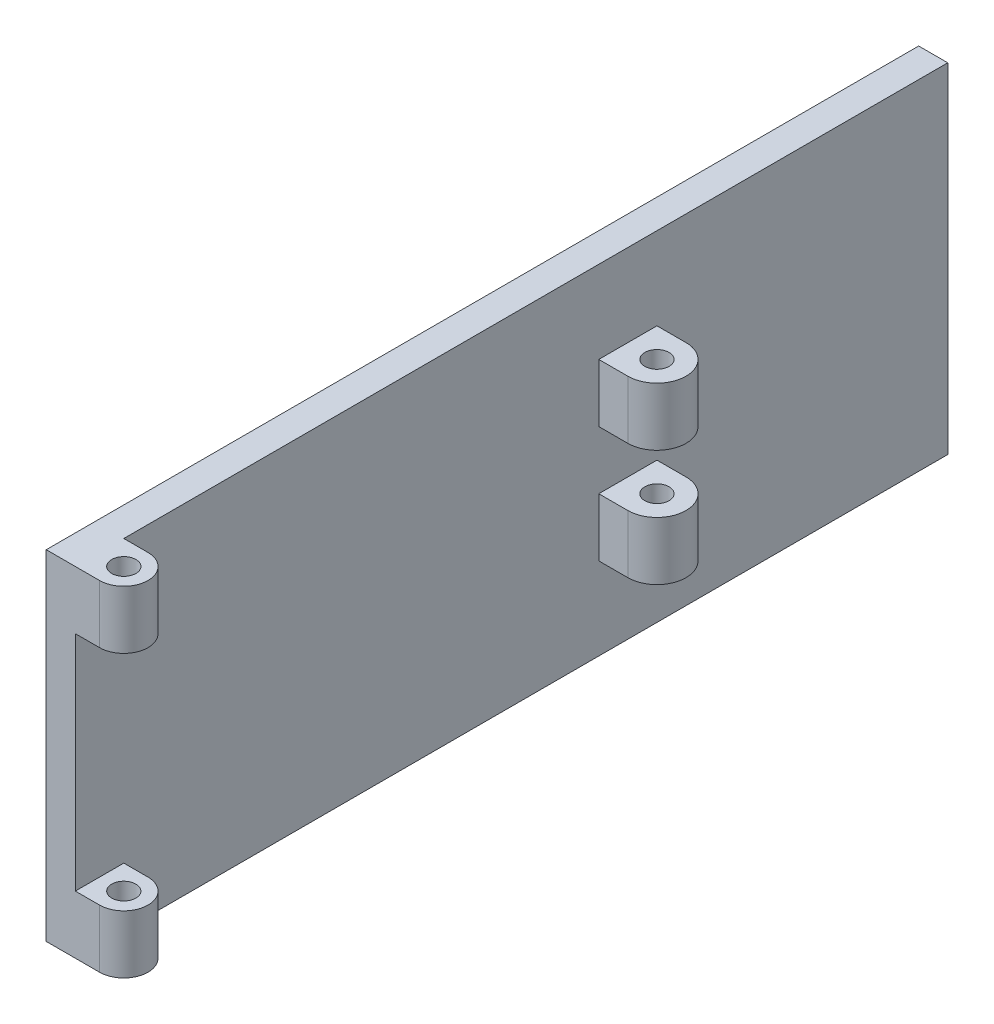
from build123d import *

# Parameters (mm, degrees)
SKETCH_1_W               = 90
SKETCH_1_H               = 35
EXTRUDE_1_DEPTH          = 3
SKETCH_2_W               = 5
SKETCH_2_H               = 6
EXTRUDE_2_DEPTH          = 5
SKETCH_3_R               = 1.25
CUT_EXTRUDE_1_DEPTH      = 97.896852374
SKETCH_4_W               = 6
SKETCH_4_H               = 6
EXTRUDE_3_DEPTH          = 6
CUT_EXTRUDE_2_DEPTH      = 95.25099469
CUT_EXTRUDE_2_DEPTH_BACK = 95.25099469
SKETCH_5_R               = 1.25


with BuildPart() as part:
    # Эскиз1 → Бобышка-Вытянуть1 (new body)
    with BuildSketch(Plane(origin=(0, 0, 0), x_dir=(0, 0, -1), z_dir=(1, 0, 0))):
        with Locations((45, 17.5)):
            Rectangle(SKETCH_1_W, SKETCH_1_H)
    extrude(amount=EXTRUDE_1_DEPTH)

    # Эскиз2 → Бобышка-Вытянуть2 (add)
    with BuildSketch(Plane(origin=(3, 0, 0), x_dir=(0, 0, -1), z_dir=(1, 0, 0))):
        with Locations((2.5, 32)):
            Rectangle(SKETCH_2_W, SKETCH_2_H)
        with Locations((2.5, 3)):
            Rectangle(SKETCH_2_W, SKETCH_2_H)
    extrude(amount=EXTRUDE_2_DEPTH)

    # Эскиз3 → Вырез-Вытянуть1 (cut, through all)
    with BuildSketch(Plane(origin=(0, 0, 0), x_dir=(-1, 0, 0), z_dir=(0, -1, 0))):
        with Locations(Location((-5.5, 2.5, 0), (0, 0, 90))):
            Circle(SKETCH_3_R)
        with BuildLine():
            Line((-8, 5), (-8, 2.5))
            ThreePointArc((-8, 2.5), (-7.267766953, 4.267766953), (-5.5, 5))
            Line((-5.5, 5), (-8, 5))
        make_face()
        with BuildLine():
            Line((-8, 0), (-5.5, 0))
            ThreePointArc((-5.5, 0), (-7.267766953, 0.732233047), (-8, 2.5))
            Line((-8, 2.5), (-8, 0))
        make_face()
    extrude(amount=-CUT_EXTRUDE_1_DEPTH, mode=Mode.SUBTRACT)

    # Эскиз4 → Бобышка-Вытянуть3 (add)
    with BuildSketch(Plane(origin=(3, 0, 0), x_dir=(0, 0, -1), z_dir=(1, 0, 0))):
        with Locations((57, 23.5)):
            Rectangle(SKETCH_4_W, SKETCH_4_H)
        with Locations((57, 11.5)):
            Rectangle(SKETCH_4_W, SKETCH_4_H)
    extrude(amount=EXTRUDE_3_DEPTH)

    # Эскиз5 → Вырез-Вытянуть2 (cut, two sides: drawn at the far end of the back side and taken through both)
    with BuildSketch(Plane(origin=(0, 8.5, 0), x_dir=(-1, 0, 0), z_dir=(0, -1, 0)).offset(-CUT_EXTRUDE_2_DEPTH_BACK)):
        with Locations(Location((-6, 57, 0), (0, 0, 90))):
            Circle(SKETCH_5_R)
        with BuildLine():
            Line((-9, 60), (-9, 57.000000015))
            ThreePointArc((-9, 57.000000015), (-8.121320338, 59.121320349), (-6, 60))
            Line((-6, 60), (-9, 60))
        make_face()
        with BuildLine():
            Line((-9, 54), (-6, 54))
            ThreePointArc((-6, 54), (-8.121320349, 54.878679662), (-9, 57.000000015))
            Line((-9, 57.000000015), (-9, 54))
        make_face()
    extrude(amount=CUT_EXTRUDE_2_DEPTH + CUT_EXTRUDE_2_DEPTH_BACK, mode=Mode.SUBTRACT)


solid = part.part
